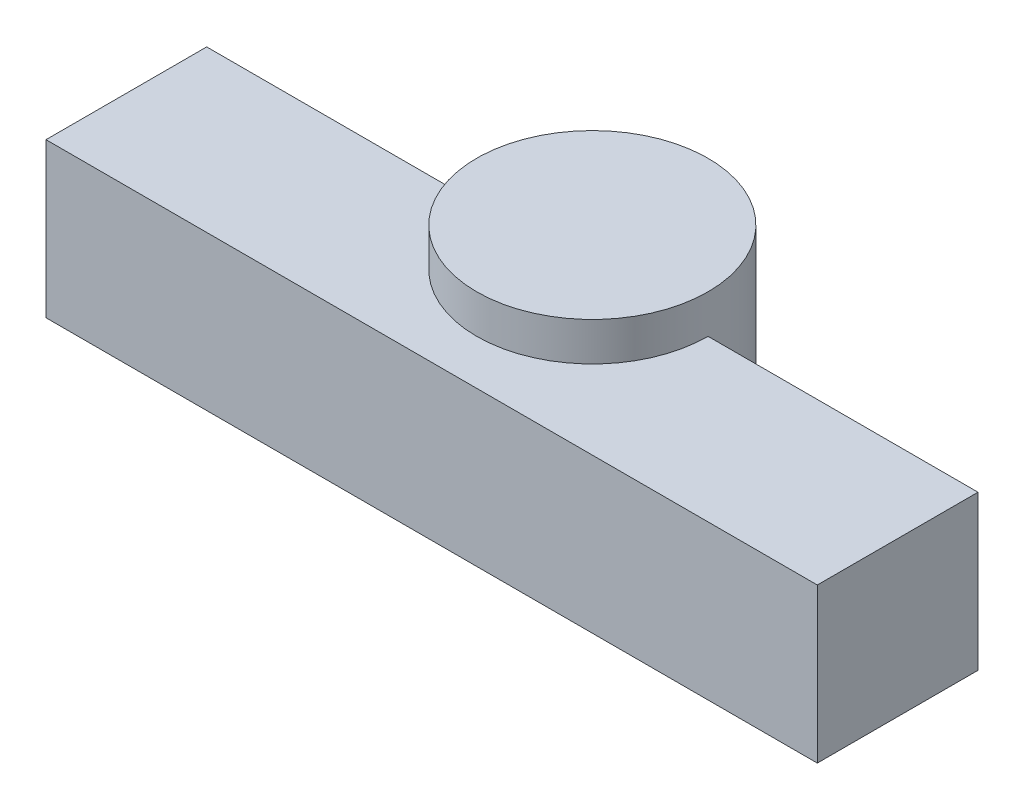
from build123d import *

# Parameters (mm, degrees)
SKETCH_1_W      = 120000
SKETCH_1_H      = 24000
EXTRUDE_1_DEPTH = 25000
SKETCH_2_R      = 18000
EXTRUDE_2_DEPTH = 30000


with BuildPart() as part:
    # 草图1 → 凸台-拉伸1 (new body)
    with BuildSketch(Plane.XY):
        with Locations((0, 12000)):
            Rectangle(SKETCH_1_W, SKETCH_1_H)
    extrude(amount=EXTRUDE_1_DEPTH)

    # 草图2 → 凸台-拉伸2 (add)
    with BuildSketch(Plane(origin=(0, 0, 0), x_dir=(1, 0, 0), z_dir=(0, 1, 0))):
        Circle(SKETCH_2_R)
    extrude(amount=EXTRUDE_2_DEPTH)


solid = part.part
